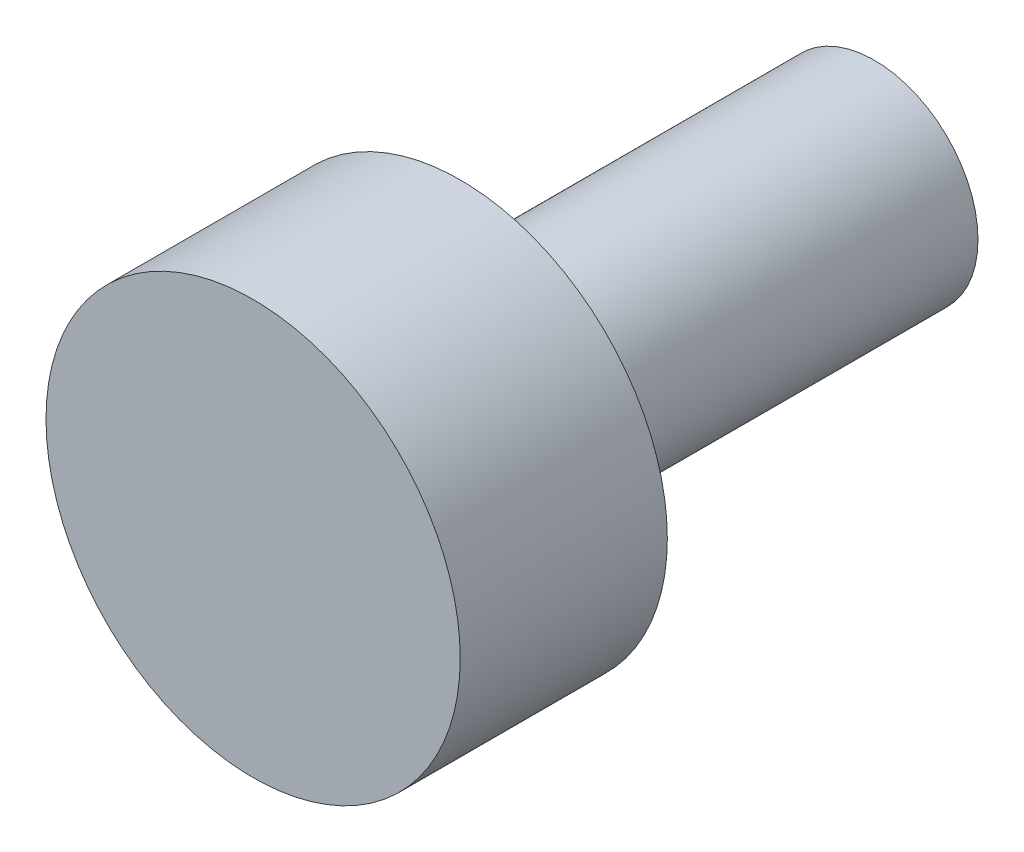
from build123d import *

# Parameters (mm, degrees)
SKETCH1_R           = 25.4
BOSS_EXTRUDE2_DEPTH = 25.4
SKETCH2_R           = 12.7
BOSS_EXTRUDE4_DEPTH = 50.8


with BuildPart() as part:
    # Sketch1 → Boss-Extrude2 (new body)
    with BuildSketch(Plane.XY):
        Circle(SKETCH1_R)
    extrude(amount=BOSS_EXTRUDE2_DEPTH)

    # Sketch2 → Boss-Extrude4 (add)
    with BuildSketch(Plane.XY):
        Circle(SKETCH2_R)
    extrude(amount=-BOSS_EXTRUDE4_DEPTH)


solid = part.part
